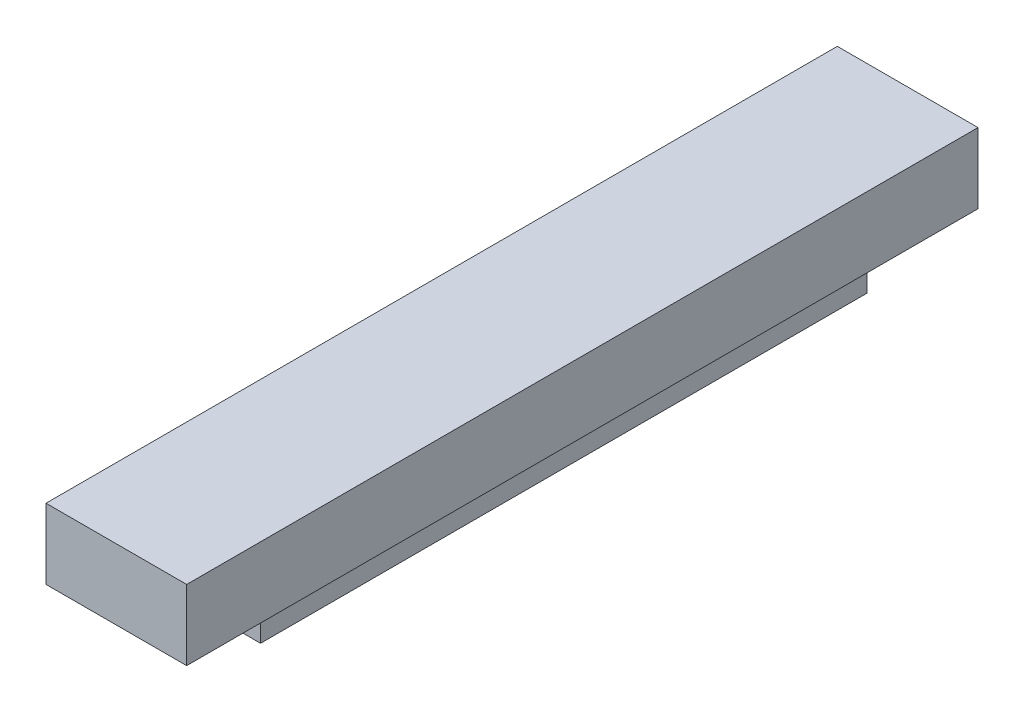
from build123d import *

# Parameters (mm, degrees)
CROQUIS1_W              = 8
CROQUIS1_H              = 45
SALIENTE_EXTRUIR1_DEPTH = 4
CROQUIS2_W              = 5
CROQUIS2_H              = 34.5
SALIENTE_EXTRUIR2_DEPTH = 4


with BuildPart() as part:
    # Croquis1 → Saliente-Extruir1 (new body)
    with BuildSketch(Plane(origin=(0, 0, 0), x_dir=(1, 0, 0), z_dir=(0, 1, 0))):
        with Locations((4, 22.5)):
            Rectangle(CROQUIS1_W, CROQUIS1_H)
    extrude(amount=SALIENTE_EXTRUIR1_DEPTH)

    # Croquis2 → Saliente-Extruir2 (add)
    with BuildSketch(Plane.XZ):
        with Locations((2.5, -24.45)):
            Rectangle(CROQUIS2_W, CROQUIS2_H)
    extrude(amount=SALIENTE_EXTRUIR2_DEPTH)


solid = part.part
